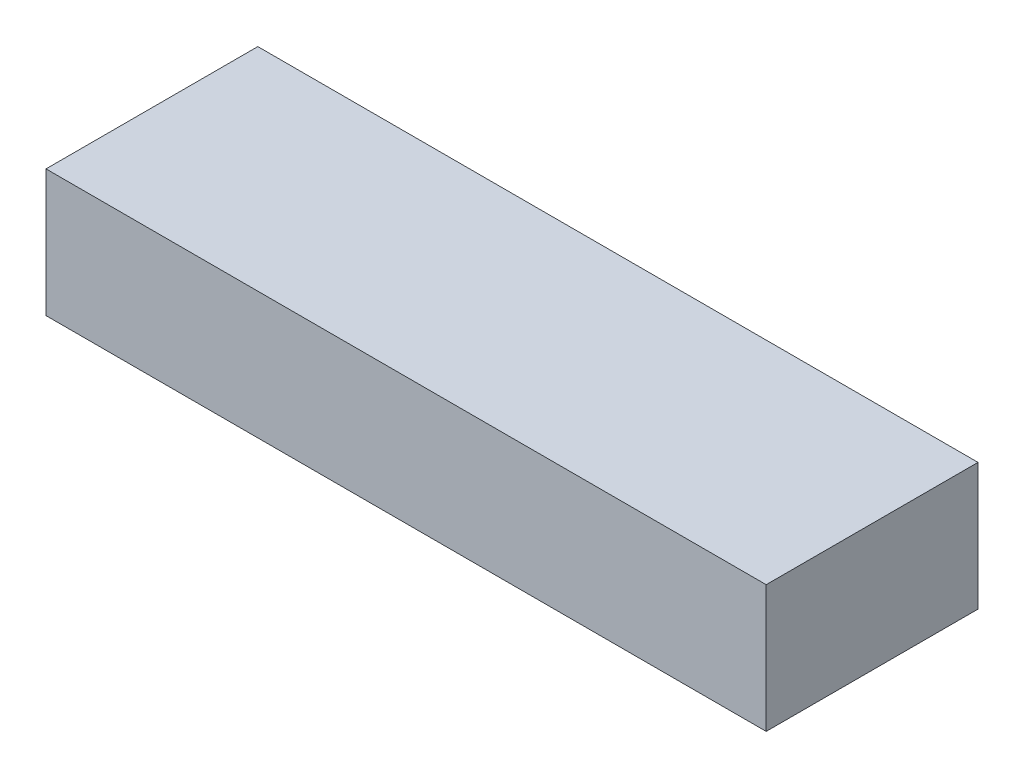
from build123d import *

# Parameters (mm, degrees)
SKETCH1_W           = 68
SKETCH1_H           = 20
BOSS_EXTRUDE1_DEPTH = 6


with BuildPart() as part:
    # Sketch1 → Boss-Extrude1 (new, symmetric)
    with BuildSketch(Plane(origin=(0, 0, 0), x_dir=(1, 0, 0), z_dir=(0, 1, 0))):
        Rectangle(SKETCH1_W, SKETCH1_H)
    extrude(amount=BOSS_EXTRUDE1_DEPTH, both=True)


solid = part.part
